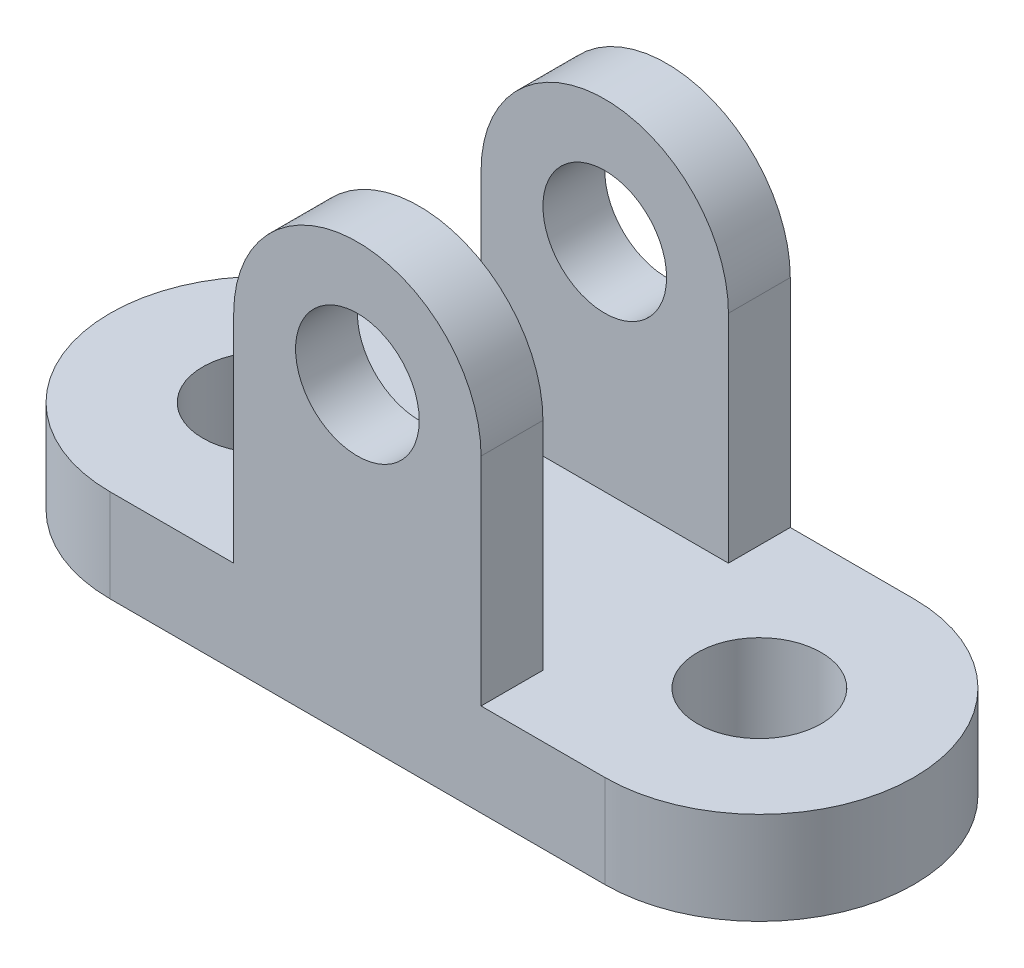
from build123d import *

# Parameters (mm, degrees)
BOSS_EXTRUDE1_DEPTH   = 15
SKETCH2_W             = 40
SKETCH2_H             = 55
BOSS_EXTRUDE2_DEPTH   = 25
FILLET1_RADIUS        = 20
FILLET1_LENGTH        = 50
SKETCH3_W             = 164.626455747
SKETCH3_H             = 30
CUT_EXTRUDE1_DEPTH    = 89.741196746
F_1_0MM_DOWEL_HOLE1_D = 20
F_1_0MM_DOWEL_HOLE2_D = 20


with BuildPart() as part:
    # Sketch1 → Boss-Extrude1 (new body)
    with BuildSketch(Plane(origin=(0, 0, 0), x_dir=(1, 0, 0), z_dir=(0, 1, 0))):
        with BuildLine():
            Line((-40, 25), (40, 25))
            ThreePointArc((40, 25), (65, 0), (40, -25))
            Line((40, -25), (-40, -25))
            ThreePointArc((-40, -25), (-65, 0), (-40, 25))
        make_face()
    extrude(amount=BOSS_EXTRUDE1_DEPTH)

    # Sketch2 → Boss-Extrude2 (add, symmetric)
    with BuildSketch(Plane.XY):
        with Locations((0, 42.5)):
            Rectangle(SKETCH2_W, SKETCH2_H)
    extrude(amount=BOSS_EXTRUDE2_DEPTH, both=True)

    # Fillet1: full round fillet: the end face becomes a half cylinder, R = half its width
    fillet1_face = Plane((0, 70, 0), x_dir=(0, 0, 1), z_dir=(0, 1, 0))  # on the end face: x along it, z out of the body
    fillet1_slab = fillet1_face.offset(-FILLET1_RADIUS / 2) * Box(FILLET1_LENGTH, 2 * FILLET1_RADIUS, FILLET1_RADIUS, mode=Mode.PRIVATE)  # the body's end, R deep
    fillet1_round = Plane((0, 50, 0), x_dir=(0, 1, 0), z_dir=(0, 0, 1)) * Cylinder(FILLET1_RADIUS, FILLET1_LENGTH, mode=Mode.PRIVATE)  # its axis R under the face
    add(fillet1_slab - fillet1_round, mode=Mode.SUBTRACT)

    # Sketch3 → Cut-Extrude1 (cut, through all)
    with BuildSketch(Plane(origin=(0, 15, 0), x_dir=(1, 0, 0), z_dir=(0, 1, 0))):
        with Locations((1.759986781, 0)):
            Rectangle(SKETCH3_W, SKETCH3_H)
    extrude(amount=CUT_EXTRUDE1_DEPTH, mode=Mode.SUBTRACT)

    # Ø1.0mm Dowel Hole1 (through all)
    with Locations(Plane(origin=(0, 15, 0), x_dir=(1, 0, 0), z_dir=(0, 1, 0))):
        with Locations((-40, 0), (40, 0)):
            Hole(F_1_0MM_DOWEL_HOLE1_D / 2)

    # Ø1.0mm Dowel Hole2 (through all)
    with Locations(Plane.XY.offset(25)):
        with Locations((0, 50)):
            Hole(F_1_0MM_DOWEL_HOLE2_D / 2)


solid = part.part
